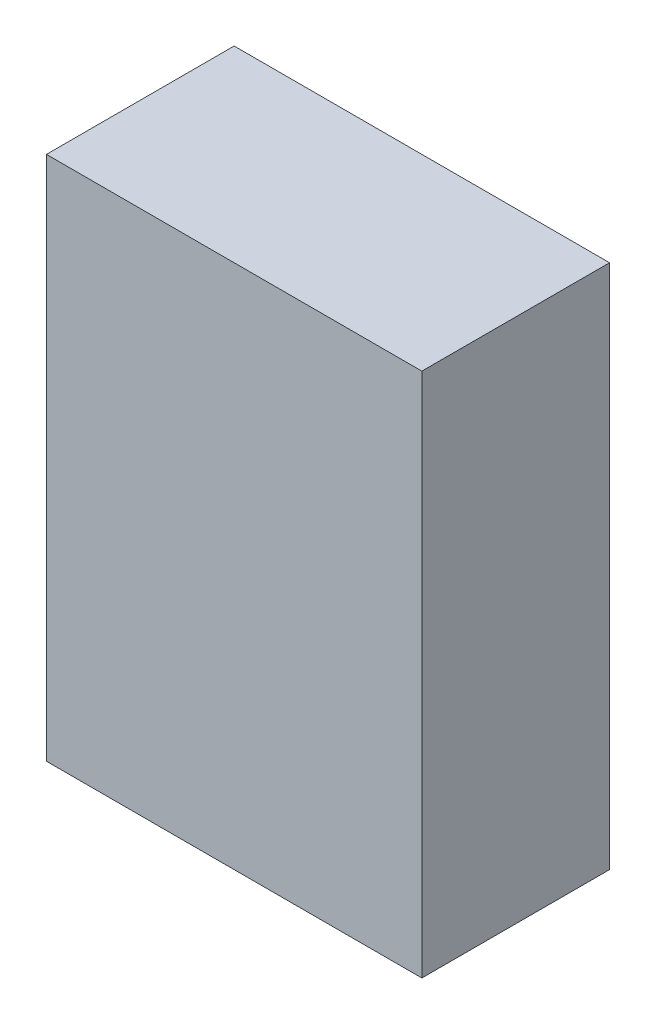
from build123d import *

# Parameters (mm, degrees)
SKETCH_1_W      = 500
SKETCH_1_H      = 700
EXTRUDE_1_DEPTH = 250


with BuildPart() as part:
    # 草圖1 → 填料-伸長1 (new body)
    with BuildSketch(Plane.XY):
        with Locations((250, 350)):
            Rectangle(SKETCH_1_W, SKETCH_1_H)
    extrude(amount=EXTRUDE_1_DEPTH)


solid = part.part
